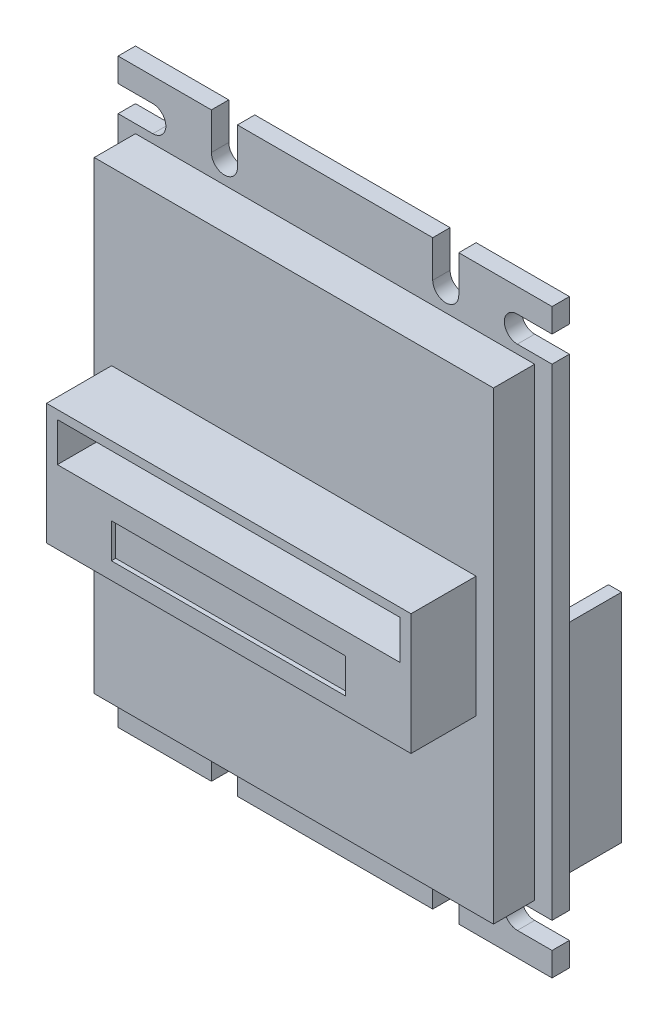
from build123d import *

# Parameters (mm, degrees)
BOSS_EXTRUDE1_DEPTH = 4
SKETCH2_W           = 92
SKETCH2_H           = 107
BOSS_EXTRUDE2_DEPTH = 13.5
SKETCH3_W           = 84
SKETCH3_H           = 27.9
BOSS_EXTRUDE3_DEPTH = 15
SKETCH4_W           = 79
SKETCH4_H           = 9
CUT_EXTRUDE1_DEPTH  = 89.324685111
SKETCH5_W           = 54
SKETCH5_H           = 8
CUT_EXTRUDE2_DEPTH  = 1
BOSS_EXTRUDE4_DEPTH = 17


with BuildPart() as part:
    # Sketch1 → Boss-Extrude1 (new body)
    with BuildSketch(Plane.XY):
        with BuildLine():
            Line((22.5, 58.5), (22.5, 67))
            Line((22.5, 67), (-22.5, 67))
            Line((-22.5, 67), (-22.5, 58.5))
            ThreePointArc((-22.5, 58.5), (-25.5, 55.5), (-28.5, 58.5))
            Line((-28.5, 58.5), (-28.5, 67))
            Line((-28.5, 67), (-50, 67))
            Line((-50, 67), (-50, 61.5))
            Line((-50, 61.5), (-42, 61.5))
            ThreePointArc((-42, 61.5), (-39, 58.5), (-42, 55.5))
            Line((-42, 55.5), (-50, 55.5))
            Line((-50, 55.5), (-50, -55.5))
            Line((-50, -55.5), (-42, -55.5))
            ThreePointArc((-42, -55.5), (-39, -58.5), (-42, -61.5))
            Line((-42, -61.5), (-50, -61.5))
            Line((-50, -61.5), (-50, -67))
            Line((-50, -67), (-28.5, -67))
            Line((-28.5, -67), (-28.5, -58.5))
            ThreePointArc((-28.5, -58.5), (-25.5, -55.5), (-22.5, -58.5))
            Line((-22.5, -58.5), (-22.5, -67))
            Line((-22.5, -67), (22.5, -67))
            Line((22.5, -67), (22.5, -58.5))
            ThreePointArc((22.5, -58.5), (25.5, -55.5), (28.5, -58.5))
            Line((28.5, -58.5), (28.5, -67))
            Line((28.5, -67), (50, -67))
            Line((50, -67), (50, -61.5))
            Line((50, -61.5), (42, -61.5))
            ThreePointArc((42, -61.5), (39, -58.5), (42, -55.5))
            Line((42, -55.5), (50, -55.5))
            Line((50, -55.5), (50, 55.5))
            Line((50, 55.5), (42, 55.5))
            ThreePointArc((42, 55.5), (39, 58.5), (42, 61.5))
            Line((42, 61.5), (50, 61.5))
            Line((50, 61.5), (50, 67))
            Line((50, 67), (28.5, 67))
            Line((28.5, 67), (28.5, 58.5))
            ThreePointArc((28.5, 58.5), (25.5, 55.5), (22.5, 58.5))
        make_face()
    extrude(amount=BOSS_EXTRUDE1_DEPTH)

    # Sketch2 → Boss-Extrude2 (add)
    with BuildSketch(Plane.XY):
        Rectangle(SKETCH2_W, SKETCH2_H)
    extrude(amount=BOSS_EXTRUDE2_DEPTH)

    # Sketch3 → Boss-Extrude3 (add)
    with BuildSketch(Plane.XY.offset(13.5)):
        Rectangle(SKETCH3_W, SKETCH3_H)
    extrude(amount=BOSS_EXTRUDE3_DEPTH)

    # Sketch4 → Cut-Extrude1 (cut, through all)
    with BuildSketch(Plane.XY.offset(28.5)):
        with Locations((0, 7.45)):
            Rectangle(SKETCH4_W, SKETCH4_H)
    extrude(amount=-CUT_EXTRUDE1_DEPTH, mode=Mode.SUBTRACT)

    # Sketch5 → Cut-Extrude2 (cut)
    with BuildSketch(Plane.XY.offset(28.5)):
        with Locations((-0.051701633, -6.019148753)):
            Rectangle(SKETCH5_W, SKETCH5_H)
    extrude(amount=-CUT_EXTRUDE2_DEPTH, mode=Mode.SUBTRACT)

    # Sketch6 → Boss-Extrude4 (add)
    with BuildSketch(Plane(origin=(0, 0, 0), x_dir=(-1, 0, 0), z_dir=(0, 0, -1))):
        Polygon((-45, -53), (45, -53), (45, -3), (42, -3), (42, -50), (-42, -50), (-42, -3), (-45, -3), align=None)
    extrude(amount=BOSS_EXTRUDE4_DEPTH)


solid = part.part
